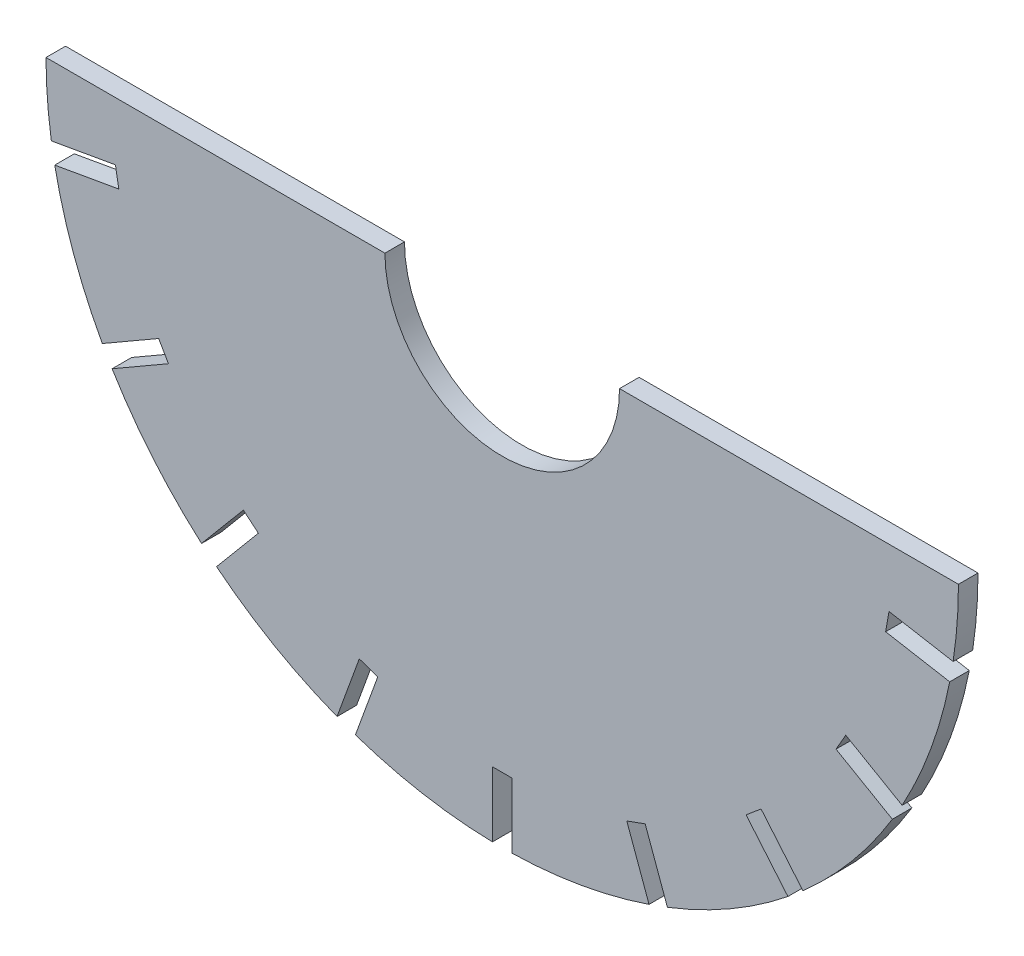
from build123d import *

# Parameters (mm, degrees)
BOSS_EXTRUDE1_DEPTH             = 3
SKETCH5_W                       = 3
SKETCH5_H                       = 10
CUT_EXTRUDE2_DEPTH              = 100.040395799
CIRPATTERN1_COUNT               = 5
CIRPATTERN1_ANGLE               = 80
CIRPATTERN1_THE_OTHER_WAY_COUNT = 5
CIRPATTERN1_THE_OTHER_WAY_ANGLE = 80
SKETCH6_R                       = 18
CUT_EXTRUDE3_DEPTH              = 100.029036146


with BuildPart() as part:
    # Sketch4 → Boss-Extrude1 (new body)
    with BuildSketch(Plane.XY):
        with BuildLine():
            Line((70, 0), (-70, 0))
            ThreePointArc((-70, 0), (0, -70), (70, 0))
        make_face()
    extrude(amount=BOSS_EXTRUDE1_DEPTH)

    # Sketch5 → Cut-Extrude2 (cut, through all)
    with BuildSketch(Plane.XY):
        with Locations((0, -65)):
            Rectangle(SKETCH5_W, SKETCH5_H)
    cut_extrude2 = extrude(amount=CUT_EXTRUDE2_DEPTH, mode=Mode.SUBTRACT)

    # CirPattern1: Cut-Extrude2 ×5 about axis
    cirpattern1_axis = Axis((0, 0, 3), (0, 0, -1))
    for i in range(1, CIRPATTERN1_COUNT):
        add(cut_extrude2.rotate(cirpattern1_axis, i * CIRPATTERN1_ANGLE / (CIRPATTERN1_COUNT - 1)), mode=Mode.SUBTRACT)

    # CirPattern1 the other way: Cut-Extrude2 ×5 about axis
    cirpattern1_the_other_way_axis = Axis((0, 0, 3), (0, 0, 1))
    for i in range(1, CIRPATTERN1_THE_OTHER_WAY_COUNT):
        add(cut_extrude2.rotate(cirpattern1_the_other_way_axis, i * CIRPATTERN1_THE_OTHER_WAY_ANGLE / (CIRPATTERN1_THE_OTHER_WAY_COUNT - 1)), mode=Mode.SUBTRACT)

    # Sketch6 → Cut-Extrude3 (cut, through all)
    with BuildSketch(Plane.XY):
        Circle(SKETCH6_R)
    extrude(amount=CUT_EXTRUDE3_DEPTH, mode=Mode.SUBTRACT)


solid = part.part
